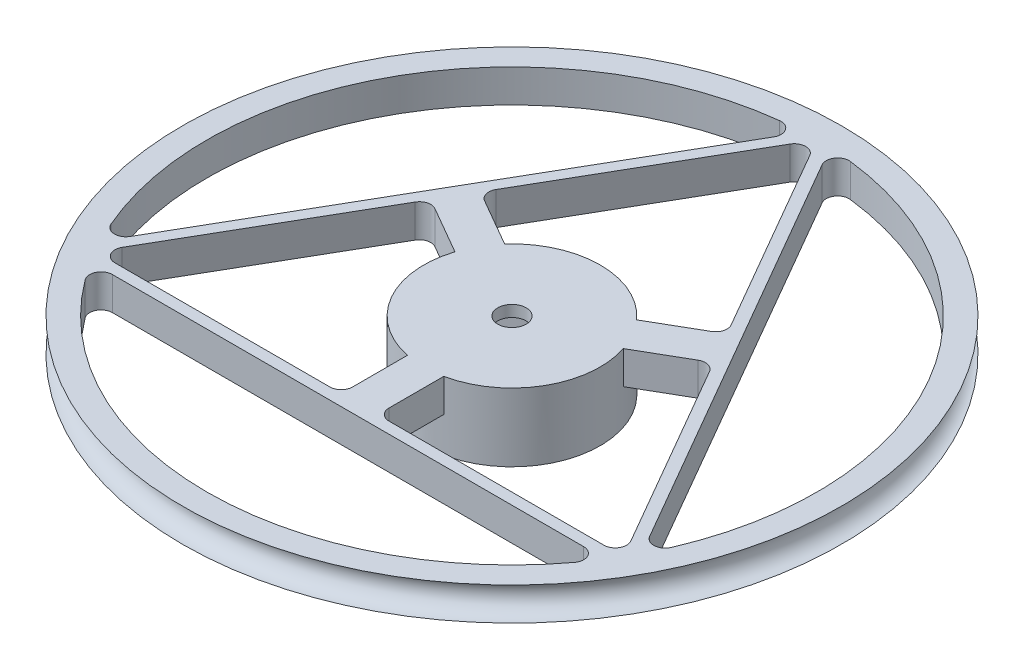
from build123d import *

# Parameters (mm, degrees)
SKETCH1_R           = 36.785134715
BOSS_EXTRUDE1_DEPTH = 3.683
SKETCH2_R           = 1.8415
BOSS_EXTRUDE2_START = -7.62
SKETCH5_R           = 9.858095427
BOSS_EXTRUDE2_DEPTH = 7.62
SKETCH6_R           = 1.5875
CUT_EXTRUDE1_DEPTH  = 53.577149714
CUT_EXTRUDE3_DEPTH  = 6.35


with BuildPart() as part:
    # Sketch1 → Boss-Extrude1 (new body)
    with BuildSketch(Plane(origin=(0, 0, 0), x_dir=(1, 0, 0), z_dir=(0, 1, 0))):
        Circle(SKETCH1_R)
        with BuildLine():
            Line((-1.099852263, 32.146289174), (-13.115875302, 11.333926765))
            ThreePointArc((-13.115875302, 11.333926765), (-13.242748838, 10.370226578), (-12.651023039, 9.599074503))
            Line((-12.651023039, 9.599074503), (-7.368281269, 6.549082119))
            ThreePointArc((-7.368281269, 6.549082119), (-8.559992893, 4.889638753), (-9.384056343, 3.020187413))
            Line((-9.384056343, 3.020187413), (-14.683023039, 6.079547262))
            ThreePointArc((-14.683023039, 6.079547262), (-15.646723226, 6.206420798), (-16.417875302, 5.614694999))
            Line((-16.417875302, 5.614694999), (-28.389429193, -15.120644587))
            ThreePointArc((-28.389429193, -15.120644587), (-28.389429193, -16.390644587), (-27.289576931, -17.025644587))
            Line((-27.289576931, -17.025644587), (-3.302, -17.025644587))
            ThreePointArc((-3.302, -17.025644587), (-2.403974388, -16.653670199), (-2.032, -15.755644587))
            Line((-2.032, -15.755644587), (-2.032, -9.646399404))
            ThreePointArc((-2.032, -9.646399404), (0, -9.858095427), (2.032, -9.646399404))
            Line((2.032, -9.646399404), (2.032, -15.755644587))
            ThreePointArc((2.032, -15.755644587), (2.403974388, -16.653670199), (3.302, -17.025644587))
            Line((3.302, -17.025644587), (27.289576931, -17.025644587))
            ThreePointArc((27.289576931, -17.025644587), (28.389429193, -16.390644587), (28.389429193, -15.120644587))
            Line((28.389429193, -15.120644587), (16.395640728, 5.65320641))
            ThreePointArc((16.395640728, 5.65320641), (15.624488653, 6.24493221), (14.660788465, 6.118058673))
            Line((14.660788465, 6.118058673), (9.370026939, 3.063436081))
            ThreePointArc((9.370026939, 3.063436081), (8.537361073, 4.929047714), (7.338026939, 6.582963322))
            Line((7.338026939, 6.582963322), (12.628788465, 9.637585914))
            ThreePointArc((12.628788465, 9.637585914), (13.220514265, 10.408737989), (13.093640728, 11.372438177))
            Line((13.093640728, 11.372438177), (1.099852263, 32.146289174))
            ThreePointArc((1.099852263, 32.146289174), (0, 32.781289174), (-1.099852263, 32.146289174))
        make_face(mode=Mode.SUBTRACT)
        with BuildLine():
            Line((-2.693461931, 31.926076262), (-28.995524051, -13.630431675))
            ThreePointArc((-28.995524051, -13.630431675), (-30.168979582, -14.26329703), (-31.261319719, -13.498895652))
            ThreePointArc((-31.261319719, -13.498895652), (-29.489281456, 17.025644587), (-3.940273302, 33.822544859))
            ThreePointArc((-3.940273302, 33.822544859), (-2.732112221, 33.258751239), (-2.693461931, 31.926076262))
        make_face(mode=Mode.SUBTRACT)
        with BuildLine():
            Line((2.693461931, 31.926076262), (28.995524051, -13.630431675))
            ThreePointArc((28.995524051, -13.630431675), (30.168979582, -14.26329703), (31.261319719, -13.498895652))
            ThreePointArc((31.261319719, -13.498895652), (29.489281456, 17.025644587), (3.940273302, 33.822544859))
            ThreePointArc((3.940273302, 33.822544859), (2.732112221, 33.258751239), (2.693461931, 31.926076262))
        make_face(mode=Mode.SUBTRACT)
        with BuildLine():
            Line((-26.302062121, -18.295644587), (26.302062121, -18.295644587))
            ThreePointArc((26.302062121, -18.295644587), (27.436867361, -18.995454209), (27.321046417, -20.323649206))
            ThreePointArc((27.321046417, -20.323649206), (0, -34.051289174), (-27.321046417, -20.323649206))
            ThreePointArc((-27.321046417, -20.323649206), (-27.436867361, -18.995454209), (-26.302062121, -18.295644587))
        make_face(mode=Mode.SUBTRACT)
    extrude(amount=BOSS_EXTRUDE1_DEPTH)

    # Sketch2 → Cut-Revolve2 (revolve, cut)
    with BuildSketch(Plane.XY):
        with Locations((36.785134715, 1.8415)):
            Circle(SKETCH2_R)
    revolve(axis=Axis((0, 0, 0), (0, 1, 0)), mode=Mode.SUBTRACT)

    # Sketch5 → Boss-Extrude2 (add)
    with BuildSketch(Plane(origin=(0, 3.683, 0), x_dir=(1, 0, 0), z_dir=(0, 1, 0)).offset(BOSS_EXTRUDE2_START)):
        Circle(SKETCH5_R)
    extrude(amount=BOSS_EXTRUDE2_DEPTH)

    # Sketch6 → Cut-Extrude1 (cut, through all)
    with BuildSketch(Plane.XZ.offset(3.937)):
        Circle(SKETCH6_R)
    extrude(amount=-CUT_EXTRUDE1_DEPTH, mode=Mode.SUBTRACT)

    # Sketch8 → Cut-Extrude3 (cut)
    with BuildSketch(Plane.XZ.offset(3.937)):
        Polygon((0, 6.35), (-5.499261314, 3.175), (-5.499261314, -3.175), (0, -6.35), (5.499261314, -3.175), (5.499261314, 3.175), align=None)
    extrude(amount=-CUT_EXTRUDE3_DEPTH, mode=Mode.SUBTRACT)


solid = part.part
